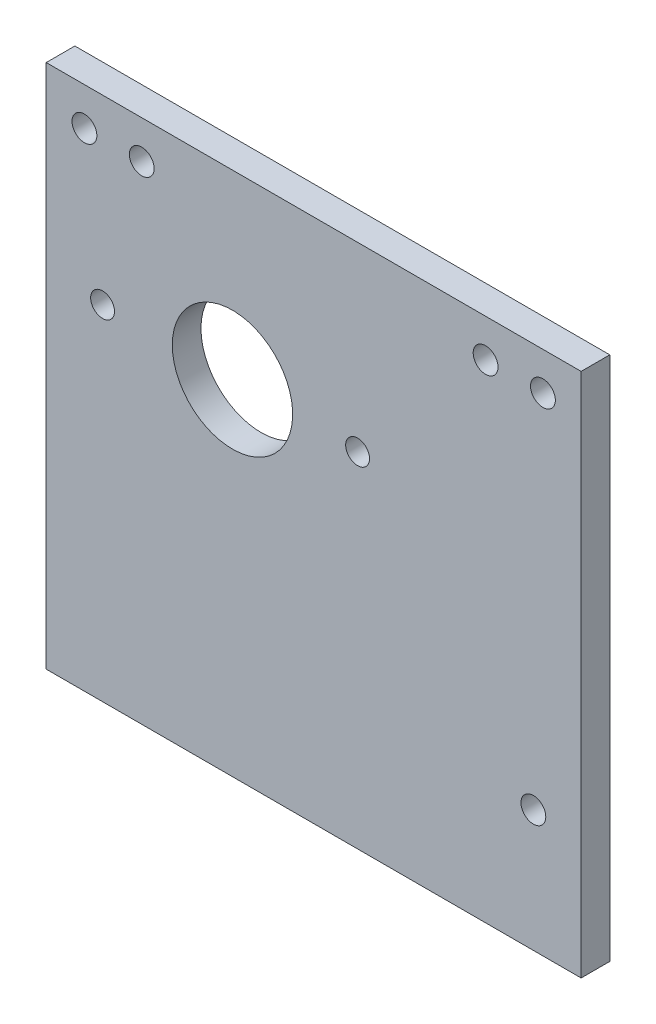
from build123d import *

# Parameters (mm, degrees)
CROQUIS1_W              = 56
CROQUIS1_H              = 55
SALIENTE_EXTRUIR1_DEPTH = 3
CROQUIS2_R              = 1.3
CORTAR_EXTRUIR1_DEPTH   = 4
CROQUIS3_R              = 6.3
CROQUIS3_R_2            = 1.25
CORTAR_EXTRUIR2_DEPTH   = 4


with BuildPart() as part:
    # Croquis1 → Saliente-Extruir1 (new body)
    with BuildSketch(Plane.XY):
        with Locations((1.5, 0)):
            Rectangle(CROQUIS1_W, CROQUIS1_H)
    extrude(amount=SALIENTE_EXTRUIR1_DEPTH)

    # Croquis2 → Cortar-Extruir1 (cut)
    with BuildSketch(Plane.XY.offset(3)):
        with Locations((25.5, 23.528824725)):
            Circle(CROQUIS2_R)
        with Locations((19.5, 23.528824725)):
            Circle(CROQUIS2_R)
        with Locations((-22.5, 23.528824725)):
            Circle(CROQUIS2_R)
        with Locations((-16.5, 23.528824725)):
            Circle(CROQUIS2_R)
        with Locations((24.5, -14.75)):
            Circle(CROQUIS2_R)
    extrude(amount=-CORTAR_EXTRUIR1_DEPTH, mode=Mode.SUBTRACT)

    # Croquis3 → Cortar-Extruir2 (cut)
    with BuildSketch(Plane(origin=(0, 0, 0), x_dir=(-1, 0, 0), z_dir=(0, 0, -1))):
        with Locations((7, 8.5)):
            Circle(CROQUIS3_R)
        with Locations((20.6, 8.5)):
            Circle(CROQUIS3_R_2)
        with Locations((-6.1, 8.5)):
            Circle(CROQUIS3_R_2)
    extrude(amount=-CORTAR_EXTRUIR2_DEPTH, mode=Mode.SUBTRACT)


solid = part.part
